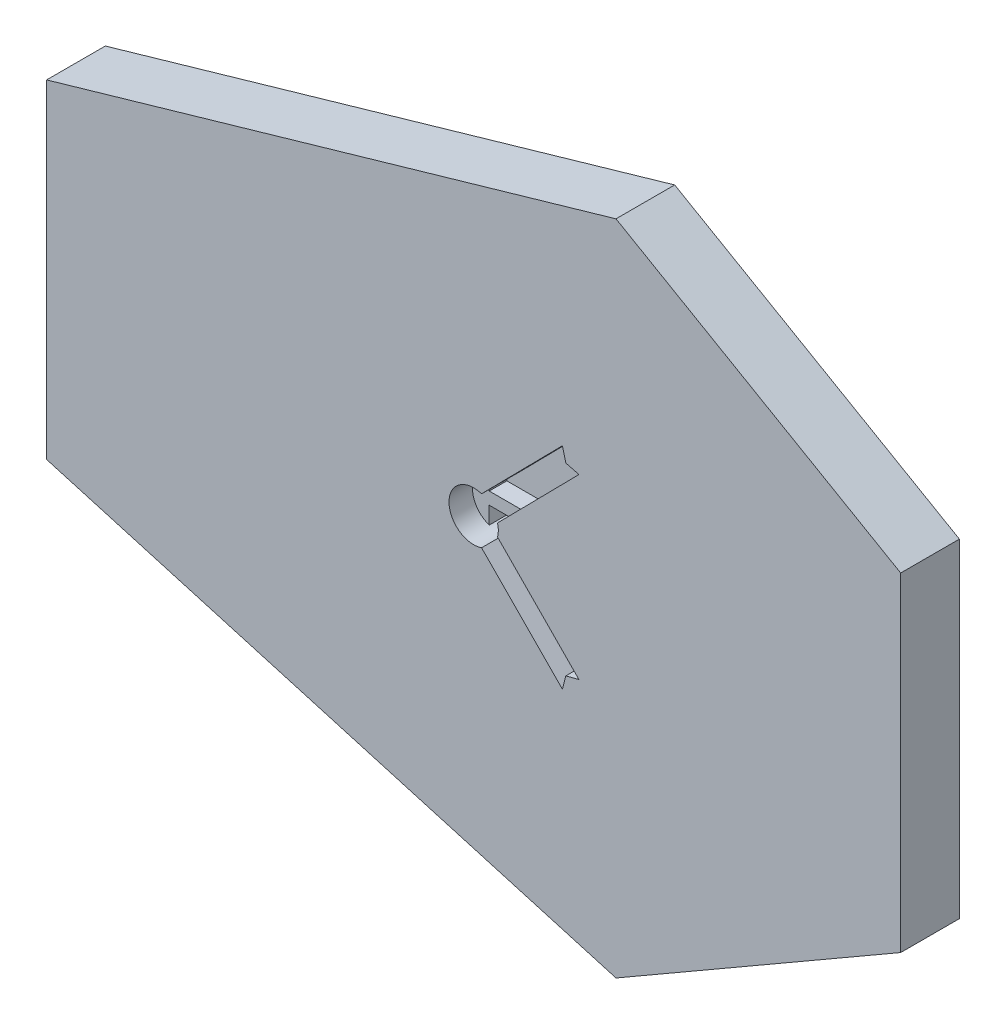
from build123d import *

# Parameters (mm, degrees)
BOSS_EXTRUDE1_DEPTH = 1.5
SKETCH4_R           = 2.1
BOSS_EXTRUDE2_DEPTH = 3.5
CUT_EXTRUDE1_DEPTH  = 3.5
CUT_EXTRUDE2_DEPTH  = 51.203735814
BOSS_EXTRUDE3_DEPTH = 1.5


with BuildPart() as part:
    # Sketch2 → Boss-Extrude1 (new body)
    with BuildSketch(Plane.XY):
        Polygon((-41.523066959, 14), (-41.523066959, -14), (6.974355653, -28), (31.223066959, -14), (31.223066959, 14), (6.974355653, 28), align=None)
    extrude(amount=BOSS_EXTRUDE1_DEPTH)

    # Sketch4 → Boss-Extrude2 (add)
    with BuildSketch(Plane.XY.offset(1.5)):
        Polygon((6.974355653, 28), (-41.523066959, 14), (-41.523066959, -14), (6.974355653, -28), (31.223066959, -14), (31.223066959, 14), align=None)
        with Locations((-5.15, 0)):
            Circle(SKETCH4_R, mode=Mode.SUBTRACT)
    extrude(amount=BOSS_EXTRUDE2_DEPTH)

    # Sketch5 → Cut-Extrude1 (cut)
    with BuildSketch(Plane.XY.offset(5)):
        Polygon((-4.477861471, 1.989530045), (-5.822138529, 1.989530045), (-5.822138529, 0.522265885), (-3.115979758, 0.522265885), (3.819278422, 7.561255379), (2.700425446, 7.850425446), (2.408714576, 8.979109263), align=None)
    cut_extrude1 = extrude(amount=-CUT_EXTRUDE1_DEPTH, mode=Mode.SUBTRACT)

    # Sketch9 → Cut-Extrude2 (cut, through all)
    with BuildSketch(Plane.XY.offset(1.5)):
        Polygon((2.408714576, 8.979109263), (2.700425446, 7.850425446), (3.819278422, 7.561255379), (2.009048725, 5.723949904), (0.584447895, 7.127556852), align=None)
    cut_extrude2 = extrude(amount=-CUT_EXTRUDE2_DEPTH, mode=Mode.SUBTRACT)

    # Mirror1: Cut-Extrude1, Cut-Extrude2 across plane
    add(cut_extrude1.mirror(Plane(origin=(0, 0, 0), x_dir=(0, 0, 1), z_dir=(0, -1, 0))), mode=Mode.SUBTRACT)
    add(cut_extrude2.mirror(Plane(origin=(0, 0, 0), x_dir=(0, 0, 1), z_dir=(0, -1, 0))), mode=Mode.SUBTRACT)

    # Sketch8 → Boss-Extrude3 (add)
    with BuildSketch(Plane.XY.offset(1.5)):
        with BuildLine():
            Line((-5.822138529, 0.522265885), (-5.822138529, 1.989530045))
            ThreePointArc((-5.822138529, 1.989530045), (-7.25, 0), (-5.822138529, -1.989530045))
            Line((-5.822138529, -1.989530045), (-5.822138529, -0.522265885))
            Line((-5.822138529, -0.522265885), (-3.115979758, -0.522265885))
            ThreePointArc((-3.115979758, -0.522265885), (-3.05, 0), (-3.115979758, 0.522265885))
            Line((-3.115979758, 0.522265885), (-5.822138529, 0.522265885))
        make_face()
    extrude(amount=BOSS_EXTRUDE3_DEPTH)


solid = part.part
